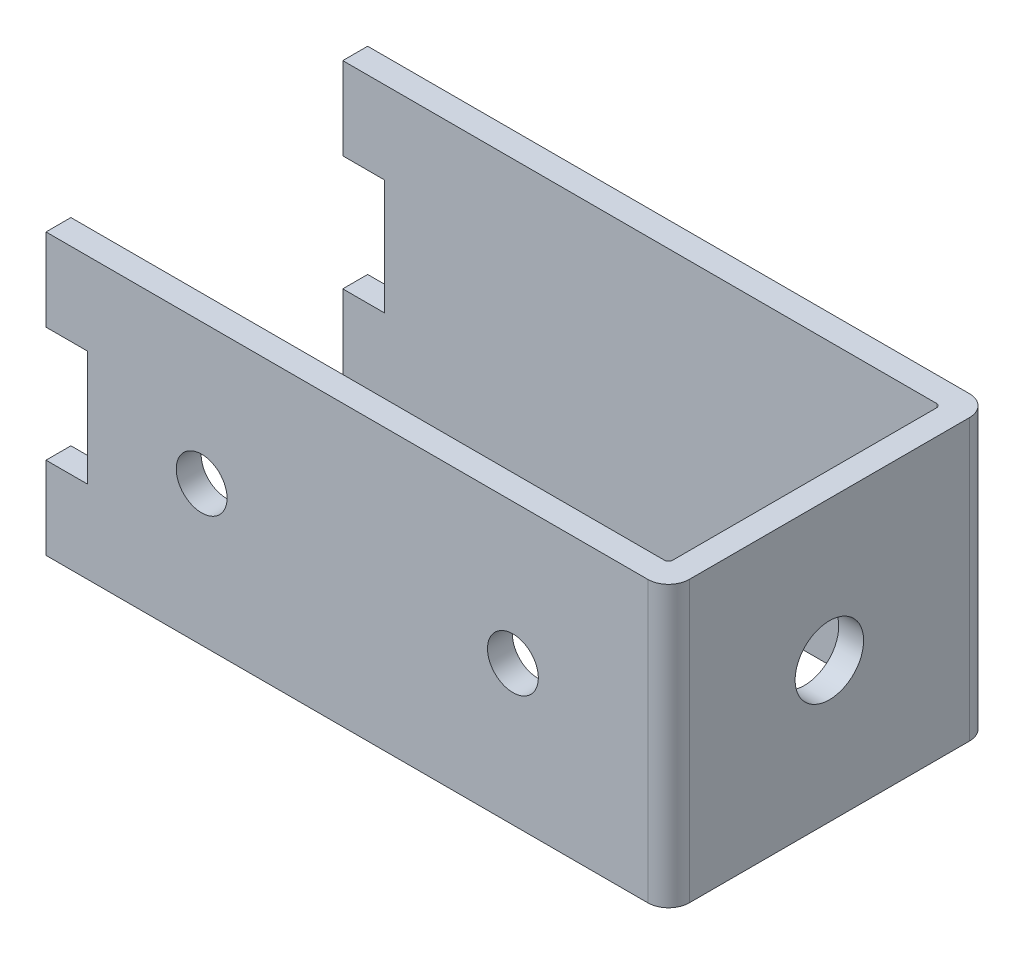
from build123d import *

# Parameters (mm, degrees)
CROQUIS1_W                 = 30
CROQUIS1_H                 = 15.5
SALIENTE_EXTRUIR1_DEPTH    = 6.75
CORTAR_EXTRUIR1_DEPTH      = 19.183096546
CORTAR_EXTRUIR1_DEPTH_BACK = 19.183096546
CROQUIS2_W                 = 28.8
CROQUIS2_H                 = 13.1
CORTAR_EXTRUIR2_REACH      = 33.712
CROQUIS3_R                 = 1.65
REDONDEO1_R                = 1
REDONDEO2_R                = 0.2
CORTAR_EXTRUIR3_DEPTH      = 19.183096546
CORTAR_EXTRUIR3_DEPTH_BACK = 19.183096546
CROQUIS4_W                 = 2
CROQUIS4_H                 = 5.55
CORTAR_EXTRUIR4_REACH      = 24.601
CROQUIS5_R                 = 1.225


with BuildPart() as part:
    # Croquis1 → Saliente-Extruir1 (new, symmetric)
    with BuildSketch(Plane(origin=(0, 0, 0), x_dir=(1, 0, 0), z_dir=(0, 1, 0))):
        Rectangle(CROQUIS1_W, CROQUIS1_H)
    extrude(amount=SALIENTE_EXTRUIR1_DEPTH, both=True)

    # Croquis2 → Cortar-Extruir1 (cut, two sides: drawn at the far end of the back side and taken through both)
    with BuildSketch(Plane(origin=(0, 0, 0), x_dir=(1, 0, 0), z_dir=(0, 1, 0)).offset(-CORTAR_EXTRUIR1_DEPTH_BACK)):
        with Locations((-0.6, 0)):
            Rectangle(CROQUIS2_W, CROQUIS2_H)
    extrude(amount=CORTAR_EXTRUIR1_DEPTH + CORTAR_EXTRUIR1_DEPTH_BACK, mode=Mode.SUBTRACT)

    # Croquis3 → Cortar-Extruir2 (cut, up to next)
    with BuildSketch(Plane(origin=(15, 0, 0), x_dir=(0, 0, -1), z_dir=(1, 0, 0)), mode=Mode.PRIVATE) as cortar_extruir2_sk1:
        Circle(CROQUIS3_R)
    cortar_extruir2_tool1 = extrude(cortar_extruir2_sk1.sketch, amount=-CORTAR_EXTRUIR2_REACH, mode=Mode.PRIVATE) & part.part
    add(cortar_extruir2_tool1.solids().sort_by_distance((15, 0, 0))[0], mode=Mode.SUBTRACT)

    # Redondeo1
    redondeo1_edges = [part.edges().sort_by_distance(p)[0] for p in [
        (15, 0, -7.75),
        (15, 0, 7.75),
    ]]
    fillet(redondeo1_edges, radius=REDONDEO1_R)

    # Redondeo2
    redondeo2_edges = [part.edges().sort_by_distance(p)[0] for p in [
        (13.8, 0, -6.55),
        (13.8, 0, 6.55),
    ]]
    fillet(redondeo2_edges, radius=REDONDEO2_R)

    # Croquis4 → Cortar-Extruir3 (cut, two sides: drawn at the far end of the back side and taken through both)
    with BuildSketch(Plane.XY.offset(-CORTAR_EXTRUIR3_DEPTH_BACK)):
        with Locations((-14, 0)):
            Rectangle(CROQUIS4_W, CROQUIS4_H)
    extrude(amount=CORTAR_EXTRUIR3_DEPTH + CORTAR_EXTRUIR3_DEPTH_BACK, mode=Mode.SUBTRACT)

    # Croquis5 → Cortar-Extruir4 (cut, up to next)
    with BuildSketch(Plane.XY.offset(7.75), mode=Mode.PRIVATE) as cortar_extruir4_sk1:
        with Locations((-7.5, 0)):
            Circle(CROQUIS5_R)
    cortar_extruir4_tool1 = extrude(cortar_extruir4_sk1.sketch, amount=-CORTAR_EXTRUIR4_REACH, mode=Mode.PRIVATE) & part.part
    # Croquis5 → Cortar-Extruir4 (cut, up to next)
    with BuildSketch(Plane.XY.offset(7.75), mode=Mode.PRIVATE) as cortar_extruir4_sk2:
        with Locations((7.5, 0)):
            Circle(CROQUIS5_R)
    cortar_extruir4_tool2 = extrude(cortar_extruir4_sk2.sketch, amount=-CORTAR_EXTRUIR4_REACH, mode=Mode.PRIVATE) & part.part
    add(cortar_extruir4_tool1.solids().sort_by_distance((-7.5, 0, 7.75))[0], mode=Mode.SUBTRACT)
    add(cortar_extruir4_tool2.solids().sort_by_distance((7.5, 0, 7.75))[0], mode=Mode.SUBTRACT)


solid = part.part
